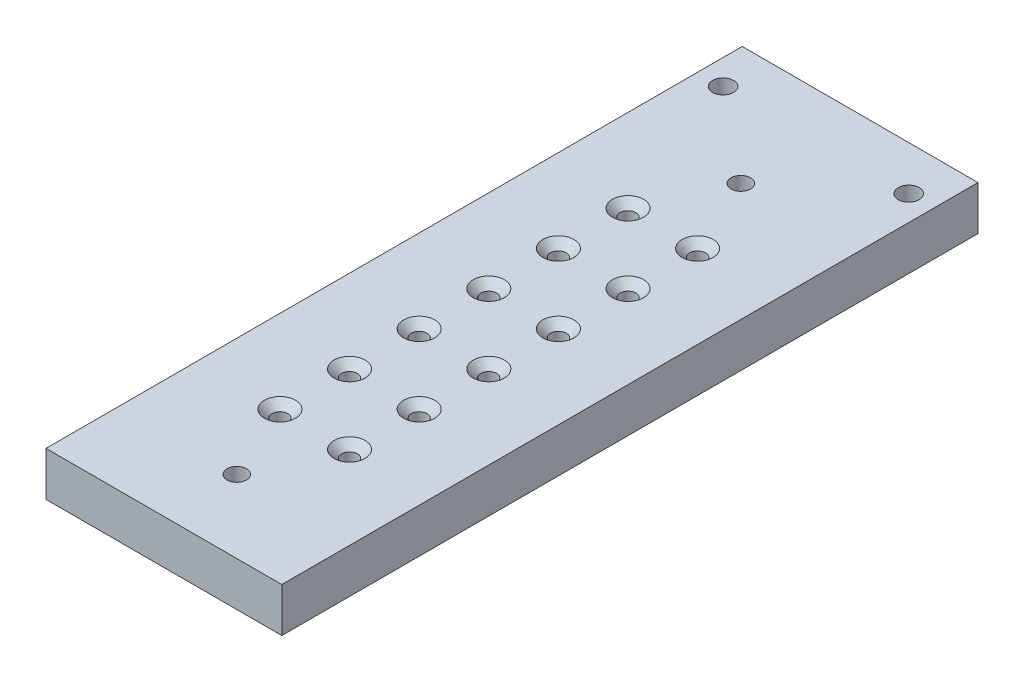
from build123d import *

# Parameters (mm, degrees)
SKETCH1_W                     = 50.8
SKETCH1_H                     = 9.525
BOSS_EXTRUDE1_DEPTH           = 75
TAP_DRILL_FOR_M5X0_8_TAP1_D   = 4.2
M4_CLEARANCE_HOLE1_D          = 4.5
CSK_FOR_M3_SFHCS1_D           = 3.4
CSK_FOR_M3_SFHCS1_CSINK_D     = 6.72
CSK_FOR_M3_SFHCS1_CSINK_ANGLE = 90
LPATTERN1_COUNT               = 6
LPATTERN1_PITCH               = 15


with BuildPart() as part:
    # Sketch1 → Boss-Extrude1 (new, symmetric)
    with BuildSketch(Plane.XY):
        Rectangle(SKETCH1_W, SKETCH1_H)
    extrude(amount=BOSS_EXTRUDE1_DEPTH, both=True)

    # Tap Drill for M5x0.8 Tap1 (through all)
    with Locations(Plane(origin=(0, 4.7625, 0), x_dir=(1, 0, 0), z_dir=(0, 1, 0))):
        with Locations((0, -59.3), (0, 49.3)):
            Hole(TAP_DRILL_FOR_M5X0_8_TAP1_D / 2)

    # M4 Clearance Hole1 (through all)
    with Locations(Plane(origin=(0, 4.7625, 0), x_dir=(1, 0, 0), z_dir=(0, 1, 0))):
        with Locations((-20, 65.475), (20, 65.475)):
            Hole(M4_CLEARANCE_HOLE1_D / 2)

    # CSK for M3 SFHCS1 (through all)
    with Locations(Plane(origin=(0, 4.7625, 0), x_dir=(1, 0, 0), z_dir=(0, 1, 0))):
        with Locations((7.5, 32.5), (-7.5, 32.5)):
            csk_for_m3_sfhcs1 = CounterSinkHole(CSK_FOR_M3_SFHCS1_D / 2, CSK_FOR_M3_SFHCS1_CSINK_D / 2, counter_sink_angle=CSK_FOR_M3_SFHCS1_CSINK_ANGLE)

    # LPattern1: CSK for M3 SFHCS1 ×6
    with Locations(*[(0, 0, i * LPATTERN1_PITCH) for i in range(1, LPATTERN1_COUNT)]):
        add(csk_for_m3_sfhcs1, mode=Mode.SUBTRACT)


solid = part.part
